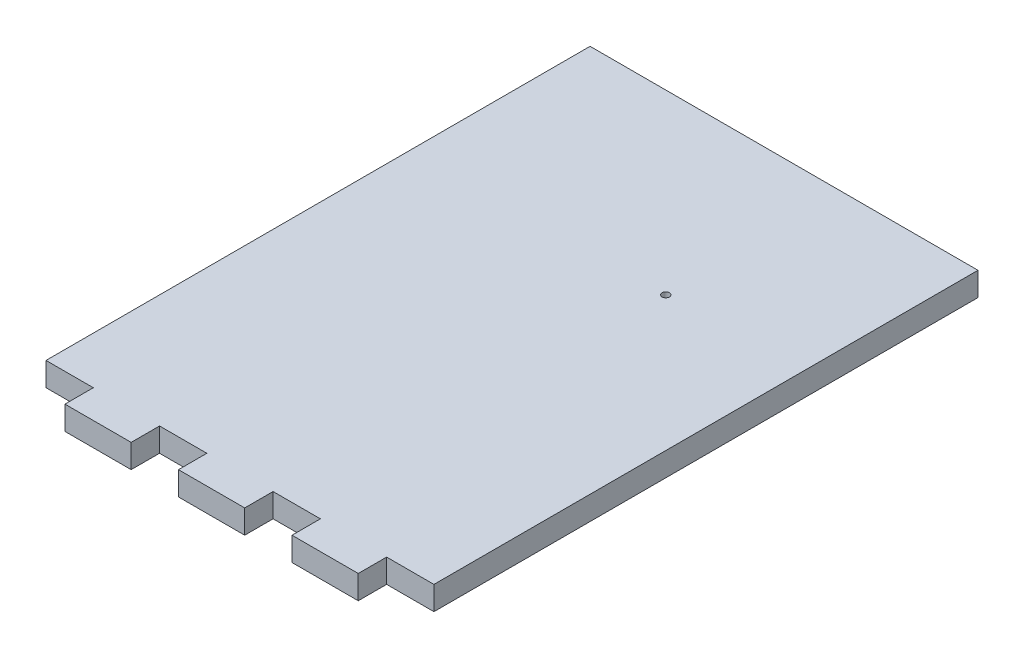
from build123d import *

# Parameters (mm, degrees)
SALIENTE_EXTRUIR1_DEPTH = 10
CROQUIS1_10_R           = 3.9
CORTAR_EXTRUIR1_DEPTH   = 6
CROQUIS1_11_R           = 1.55
CORTAR_EXTRUIR3_DEPTH   = 283.658804922


with BuildPart() as part:
    # Croquis1 → Saliente-Extruir1 (new body)
    with BuildSketch(Plane(origin=(0, 0, 0), x_dir=(1, 0, 0), z_dir=(0, 1, 0))):
        Polygon((0, 0), (20, 0), (20, -12), (48, -12), (48, 0), (68, 0), (68, -12), (96, -12), (96, 0), (116, 0), (116, -12), (144, -12), (144, 0), (164, 0), (164, 230), (0, 230), align=None)
    extrude(amount=SALIENTE_EXTRUIR1_DEPTH)

    # Croquis1<10> → Cortar-Extruir1 (cut)
    with BuildSketch(Plane(origin=(0, 0, 0), x_dir=(1, 0, 0), z_dir=(0, 1, 0))):
        with Locations((62, 190)):
            Circle(CROQUIS1_10_R)
        with Locations((102, 190)):
            Circle(CROQUIS1_10_R)
    extrude(amount=CORTAR_EXTRUIR1_DEPTH, mode=Mode.SUBTRACT)

    # Croquis1<11> → Cortar-Extruir3 (cut, through all)
    with BuildSketch(Plane(origin=(0, 0, 0), x_dir=(1, 0, 0), z_dir=(0, 1, 0))):
        with Locations((107, 155)):
            Circle(CROQUIS1_11_R)
    extrude(amount=CORTAR_EXTRUIR3_DEPTH, mode=Mode.SUBTRACT)


solid = part.part
